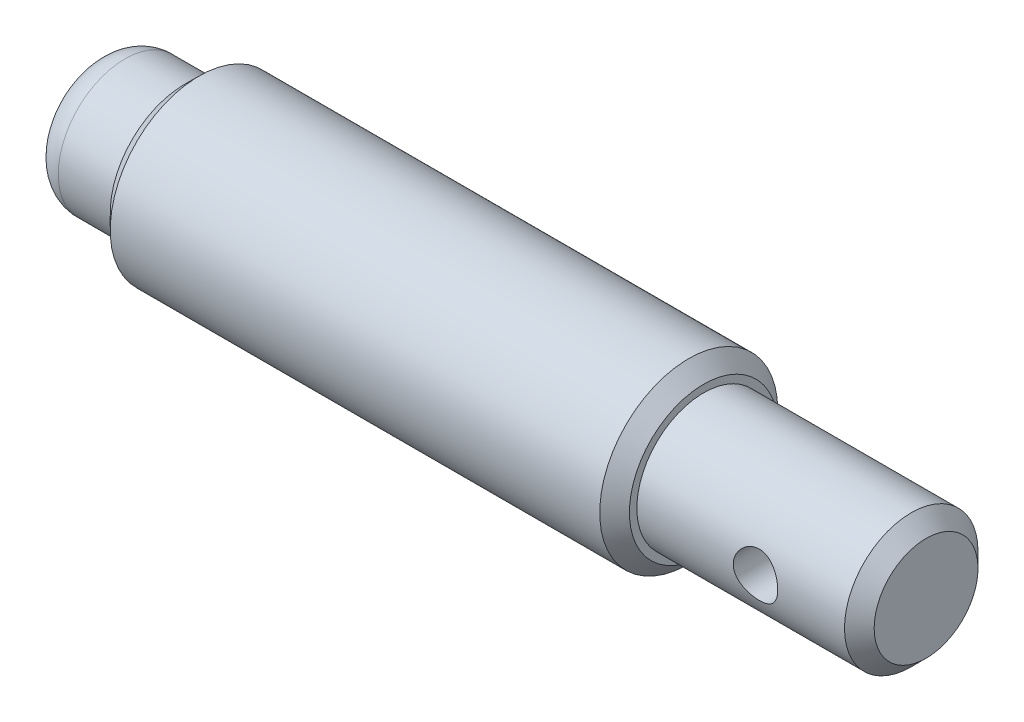
from build123d import *

# Parameters (mm, degrees)
CHAMFER2_SIZE            = 1
FILLET1_R                = 2
F_3_0_3_DIAMETER_HOLE1_D = 3


with BuildPart() as part:
    # Sketch1 → Revolve1 (revolve)
    with BuildSketch(Plane.XY, mode=Mode.PRIVATE) as revolve1_sk:
        Polygon((0, 0), (0, 4.5), (6, 4.5), (6, 6), (41, 6), (41, 4.5), (56, 4.5), (56, 0), align=None)
    revolve(revolve1_sk.sketch.rotate(Axis((0, 0, 0), (-1, 0, 0)), 90), axis=Axis((0, 0, 0), (-1, 0, 0)))

    # Chamfer2
    chamfer2_edges = [part.edges().sort_by_distance(p)[0] for p in [
        (56, 0, 4.5),
        (41, 0, 6),
        (6, 0, 6),
    ]]
    chamfer(chamfer2_edges, length=CHAMFER2_SIZE)

    # Fillet1
    fillet1_edges = [part.edges().sort_by_distance(p)[0] for p in [
        (0, 0, 4.5),
    ]]
    fillet(fillet1_edges, radius=FILLET1_R)

    # Ø3.0 (3) Diameter Hole1 (through all)
    with Locations(Plane(origin=(49, 0, 4.5), x_dir=(0, 1, 0), z_dir=(0, 0, 1))):
        with Locations((0, 0)):
            Hole(F_3_0_3_DIAMETER_HOLE1_D / 2)


solid = part.part
